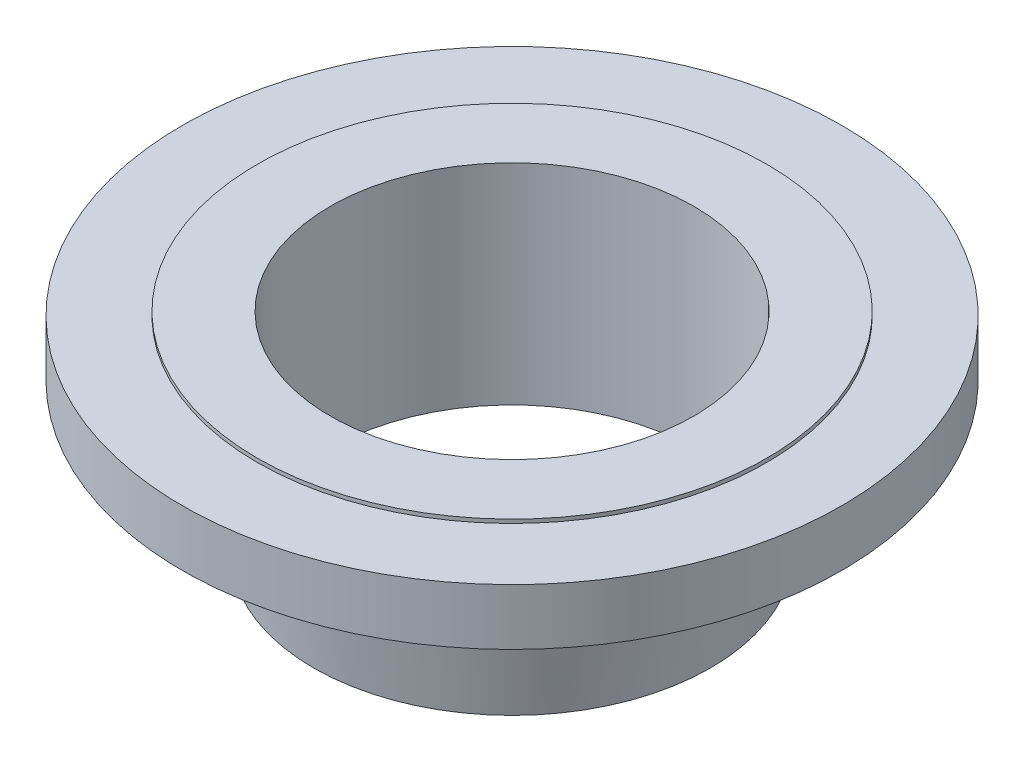
from build123d import *


with BuildPart() as part:
    # Sketch1 → Revolve1 (revolve)
    with BuildSketch(Plane(origin=(0, 0, 0), x_dir=(0, 0, -1), z_dir=(1, 0, 0))):
        Polygon((77.05, 0), (77.05, 88.9), (107.95, 88.9), (107.95, 87.3), (139.7, 87.3), (139.7, 63.5), (92.1, 63.5), (84.15, 0), align=None)
    revolve(axis=Axis((0, -50, 0), (0, 1, 0)))


solid = part.part
